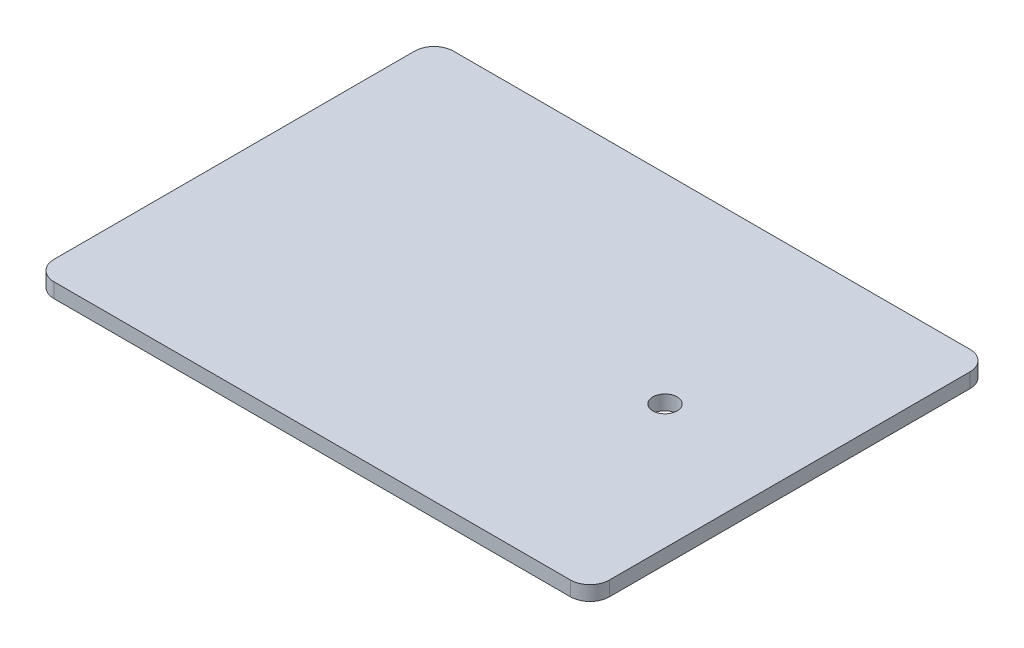
from build123d import *

# Parameters (mm, degrees)
BOSS_EXTRUDE1_DEPTH = 3
SKETCH2_R           = 2.5
CUT_EXTRUDE1_DEPTH  = 3


with BuildPart() as part:
    # Sketch1 → Boss-Extrude1 (new body)
    with BuildSketch(Plane(origin=(0, 0, 0), x_dir=(1, 0, 0), z_dir=(0, 1, 0))):
        with BuildLine():
            Line((-53, 41), (53, 41))
            ThreePointArc((53, 41), (55.828427125, 39.828427125), (57, 37))
            Line((57, 37), (57, -37))
            ThreePointArc((57, -37), (55.828427125, -39.828427125), (53, -41))
            Line((53, -41), (-53, -41))
            ThreePointArc((-53, -41), (-55.828427125, -39.828427125), (-57, -37))
            Line((-57, -37), (-57, 37))
            ThreePointArc((-57, 37), (-55.828427125, 39.828427125), (-53, 41))
        make_face()
    extrude(amount=BOSS_EXTRUDE1_DEPTH)

    # Sketch2 → Cut-Extrude1 (cut)
    with BuildSketch(Plane.XZ):
        with Locations(Location((31.4, 0, 0), (0, 0, 270))):
            Circle(SKETCH2_R)
    extrude(amount=-CUT_EXTRUDE1_DEPTH, mode=Mode.SUBTRACT)


solid = part.part
